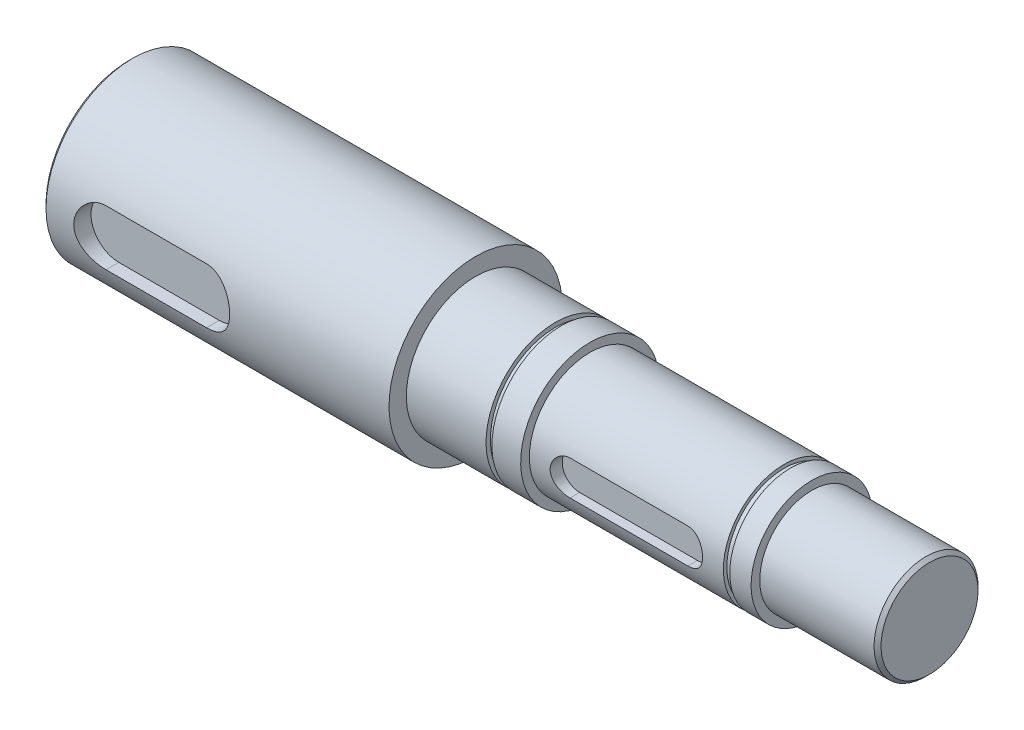
from build123d import *

# Parameters (mm, degrees)
CHAMFER_1_SIZE      = 1
CUT_EXTRUDE_START   = -8
SKETCH_2_OUTSIDE_W  = 100.316
SKETCH_2_OUTSIDE_H  = 100.316
SKETCH_2_OUTSIDE_R  = 16.5
CUT_EXTRUDE_1_DEPTH = 1.85
CUT_EXTRUDE_START_2 = -10
SKETCH_3_OUTSIDE_W  = 100.316
SKETCH_3_OUTSIDE_H  = 100.316
SKETCH_3_OUTSIDE_R  = 18.75
CUT_EXTRUDE_2_DEPTH = 1.7
CUT_EXTRUDE_START_3 = 20
CUT_EXTRUDE_3_DEPTH = 214.689965553
CUT_EXTRUDE_START_4 = 14
CUT_EXTRUDE_4_DEPTH = 220.689965574


with BuildPart() as part:
    # 草图1 → 旋转1 (revolve)
    with BuildSketch(Plane.XY):
        Polygon((0, 0), (0, 25), (100, 25), (100, 20), (133, 20), (133, 17.5), (197, 17.5), (197, 15), (231, 15), (231, 0), align=None)
    revolve(axis=Axis((231, 0, 0), (-1, 0, 0)))

    # 倒角1
    chamfer_1_edges = [part.edges().sort_by_distance(p)[0] for p in [
        (0, -25, 0),
        (231, -15, 0),
    ]]
    chamfer(chamfer_1_edges, length=CHAMFER_1_SIZE)

    # 草图2 outside → 切除-拉伸1 (cut)
    with BuildSketch(Plane(origin=(197, 0, 0), x_dir=(0, 0, -1), z_dir=(1, 0, 0)).offset(CUT_EXTRUDE_START)):
        Rectangle(SKETCH_2_OUTSIDE_W, SKETCH_2_OUTSIDE_H)
        with Locations(Location((0, 0, 0), (0, 0, 90))):
            Circle(SKETCH_2_OUTSIDE_R, mode=Mode.SUBTRACT)
    extrude(amount=CUT_EXTRUDE_1_DEPTH, mode=Mode.SUBTRACT)

    # 草图3 outside → 切除-拉伸2 (cut)
    with BuildSketch(Plane(origin=(133, 0, 0), x_dir=(0, 0, -1), z_dir=(1, 0, 0)).offset(CUT_EXTRUDE_START_2)):
        Rectangle(SKETCH_3_OUTSIDE_W, SKETCH_3_OUTSIDE_H)
        with Locations(Location((0, 0, 0), (0, 0, 90))):
            Circle(SKETCH_3_OUTSIDE_R, mode=Mode.SUBTRACT)
    extrude(amount=CUT_EXTRUDE_2_DEPTH, mode=Mode.SUBTRACT)

    # 草图4 → 切除-拉伸3 (cut, through all)
    with BuildSketch(Plane.XY.offset(CUT_EXTRUDE_START_3)):
        with BuildLine():
            Line((17, 8), (46, 8))
            ThreePointArc((46, 8), (54, 0), (46, -8))
            Line((46, -8), (17, -8))
            ThreePointArc((17, -8), (9, 0), (17, 8))
        make_face()
    extrude(amount=CUT_EXTRUDE_3_DEPTH, mode=Mode.SUBTRACT)

    # 草图5 → 切除-拉伸4 (cut, through all)
    with BuildSketch(Plane.XY.offset(CUT_EXTRUDE_START_4)):
        with BuildLine():
            Line((144, 5), (178, 5))
            ThreePointArc((178, 5), (183, 0), (178, -5))
            Line((178, -5), (144, -5))
            ThreePointArc((144, -5), (139, 0), (144, 5))
        make_face()
    extrude(amount=CUT_EXTRUDE_4_DEPTH, mode=Mode.SUBTRACT)


solid = part.part
